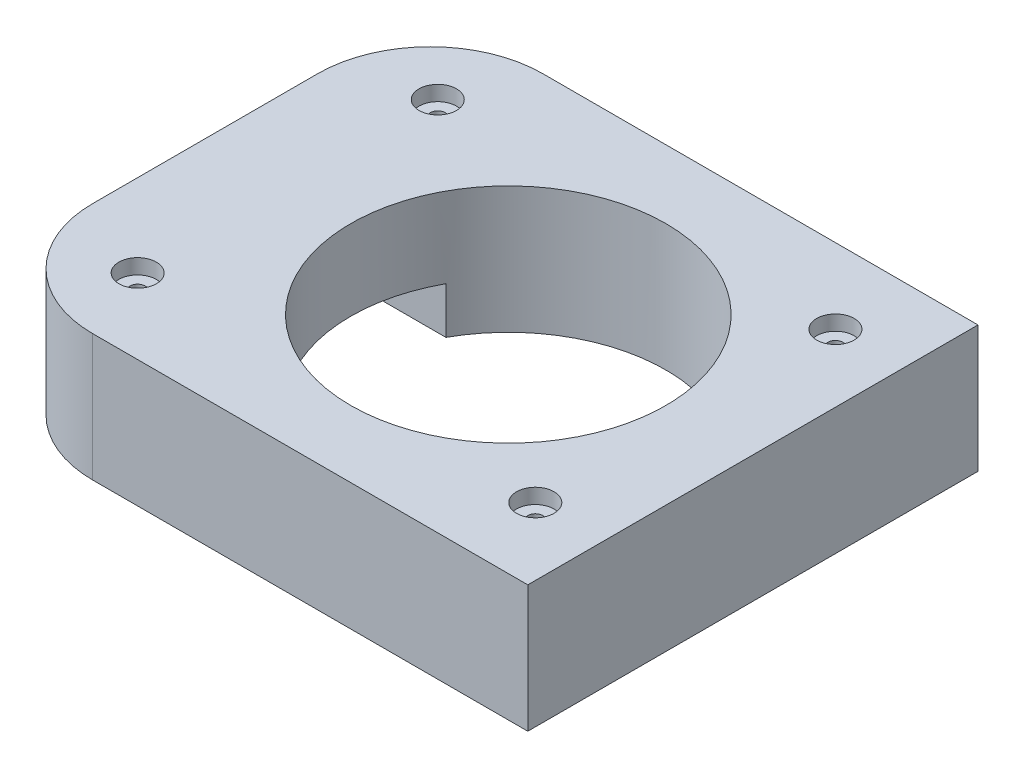
from build123d import *

# Parameters (mm, degrees)
SKETCH1_W           = 73
SKETCH1_H           = 60
BOSS_EXTRUDE1_DEPTH = 16.9
FILLET1_R           = 15
CUT_EXTRUDE1_REACH  = 57.087
SKETCH2_R           = 21
SKETCH3_W           = 40
SKETCH3_H           = 20
CUT_EXTRUDE2_DEPTH  = 6.2
CUT_EXTRUDE3_REACH  = 57.087
SKETCH4_R           = 1
SKETCH5_R           = 2.5
CUT_EXTRUDE4_DEPTH  = 2


with BuildPart() as part:
    # Sketch1 → Boss-Extrude1 (new body)
    with BuildSketch(Plane(origin=(0, 0, 0), x_dir=(1, 0, 0), z_dir=(0, 1, 0))):
        with Locations((6.5, 0)):
            Rectangle(SKETCH1_W, SKETCH1_H)
    extrude(amount=BOSS_EXTRUDE1_DEPTH)

    # Fillet1
    fillet1_edges = [part.edges().sort_by_distance(p)[0] for p in [
        (-30, 8.45, -30),
        (-30, 8.45, 30),
    ]]
    fillet(fillet1_edges, radius=FILLET1_R)

    # Sketch2 → Cut-Extrude1 (cut, up to next)
    with BuildSketch(Plane(origin=(0, 16.9, 0), x_dir=(1, 0, 0), z_dir=(0, 1, 0)), mode=Mode.PRIVATE) as cut_extrude1_sk1:
        with Locations(Location((10.5, -0.1, 0), (0, 0, 270))):
            Circle(SKETCH2_R)
    cut_extrude1_tool1 = extrude(cut_extrude1_sk1.sketch, amount=-CUT_EXTRUDE1_REACH, mode=Mode.PRIVATE) & part.part
    add(cut_extrude1_tool1.solids().sort_by_distance((10.5, 16.9, 0.1))[0], mode=Mode.SUBTRACT)

    # Sketch3 → Cut-Extrude2 (cut)
    with BuildSketch(Plane.XZ):
        with Locations((-10, 0)):
            Rectangle(SKETCH3_W, SKETCH3_H)
    extrude(amount=-CUT_EXTRUDE2_DEPTH, mode=Mode.SUBTRACT)

    # Sketch4 → Cut-Extrude3 (cut, up to next)
    with BuildSketch(Plane(origin=(0, 16.9, 0), x_dir=(1, 0, 0), z_dir=(0, 1, 0)), mode=Mode.PRIVATE) as cut_extrude3_sk1:
        with Locations(Location((34, 20, 0), (0, 0, 270))):
            Circle(SKETCH4_R)
    cut_extrude3_tool1 = extrude(cut_extrude3_sk1.sketch, amount=-CUT_EXTRUDE3_REACH, mode=Mode.PRIVATE) & part.part
    # Sketch4 → Cut-Extrude3 (cut, up to next)
    with BuildSketch(Plane(origin=(0, 16.9, 0), x_dir=(1, 0, 0), z_dir=(0, 1, 0)), mode=Mode.PRIVATE) as cut_extrude3_sk2:
        with Locations(Location((34, -20, 0), (0, 0, 270))):
            Circle(SKETCH4_R)
    cut_extrude3_tool2 = extrude(cut_extrude3_sk2.sketch, amount=-CUT_EXTRUDE3_REACH, mode=Mode.PRIVATE) & part.part
    # Sketch4 → Cut-Extrude3 (cut, up to next)
    with BuildSketch(Plane(origin=(0, 16.9, 0), x_dir=(1, 0, 0), z_dir=(0, 1, 0)), mode=Mode.PRIVATE) as cut_extrude3_sk3:
        with Locations(Location((-19, -20, 0), (0, 0, 270))):
            Circle(SKETCH4_R)
    cut_extrude3_tool3 = extrude(cut_extrude3_sk3.sketch, amount=-CUT_EXTRUDE3_REACH, mode=Mode.PRIVATE) & part.part
    # Sketch4 → Cut-Extrude3 (cut, up to next)
    with BuildSketch(Plane(origin=(0, 16.9, 0), x_dir=(1, 0, 0), z_dir=(0, 1, 0)), mode=Mode.PRIVATE) as cut_extrude3_sk4:
        with Locations(Location((-19, 20, 0), (0, 0, 270))):
            Circle(SKETCH4_R)
    cut_extrude3_tool4 = extrude(cut_extrude3_sk4.sketch, amount=-CUT_EXTRUDE3_REACH, mode=Mode.PRIVATE) & part.part
    add(cut_extrude3_tool1.solids().sort_by_distance((34, 16.9, -20))[0], mode=Mode.SUBTRACT)
    add(cut_extrude3_tool2.solids().sort_by_distance((34, 16.9, 20))[0], mode=Mode.SUBTRACT)
    add(cut_extrude3_tool3.solids().sort_by_distance((-19, 16.9, 20))[0], mode=Mode.SUBTRACT)
    add(cut_extrude3_tool4.solids().sort_by_distance((-19, 16.9, -20))[0], mode=Mode.SUBTRACT)

    # Sketch5 → Cut-Extrude4 (cut)
    with BuildSketch(Plane(origin=(0, 16.9, 0), x_dir=(1, 0, 0), z_dir=(0, 1, 0))):
        with Locations(Location((-19, 20, 0), (0, 0, 270))):
            Circle(SKETCH5_R)
        with Locations(Location((-19, -20, 0), (0, 0, 270))):
            Circle(SKETCH5_R)
        with Locations(Location((34, -20, 0), (0, 0, 270))):
            Circle(SKETCH5_R)
        with Locations(Location((34, 20, 0), (0, 0, 270))):
            Circle(SKETCH5_R)
    extrude(amount=-CUT_EXTRUDE4_DEPTH, mode=Mode.SUBTRACT)


solid = part.part
